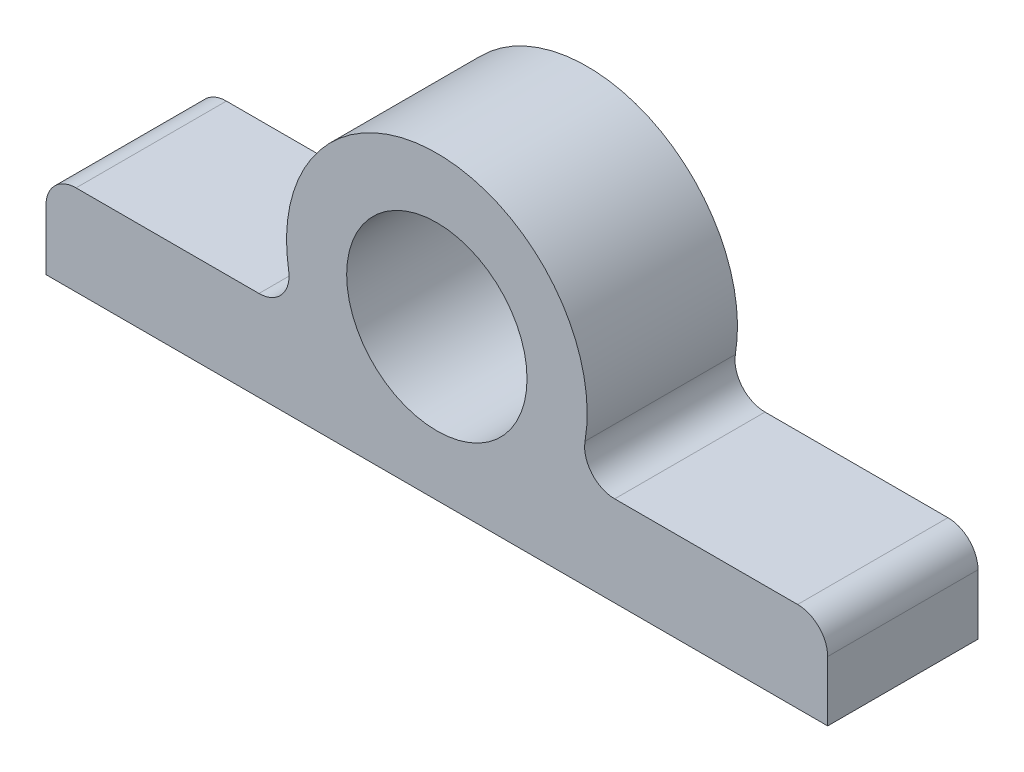
from build123d import *

# Parameters (mm, degrees)
SKETCH1_R           = 15
BOSS_EXTRUDE1_DEPTH = 25


with BuildPart() as part:
    # Sketch1 → Boss-Extrude1 (new body)
    with BuildSketch(Plane.XY):
        with BuildLine():
            Line((-65, -25), (-65, -15))
            ThreePointArc((-65, -15), (-63.535533906, -11.464466094), (-60, -10))
            Line((-60, -10), (-29.580398915, -10))
            ThreePointArc((-29.580398915, -10), (-25.761585836, -8.227486122), (-24.65033243, -4.166666667))
            ThreePointArc((-24.65033243, -4.166666667), (0, 25), (24.65033243, -4.166666667))
            ThreePointArc((24.65033243, -4.166666667), (25.761585836, -8.227486122), (29.580398915, -10))
            Line((29.580398915, -10), (60, -10))
            ThreePointArc((60, -10), (63.535533906, -11.464466094), (65, -15))
            Line((65, -15), (65, -25))
            Line((65, -25), (-65, -25))
        make_face()
        Circle(SKETCH1_R, mode=Mode.SUBTRACT)
    extrude(amount=BOSS_EXTRUDE1_DEPTH)


solid = part.part
